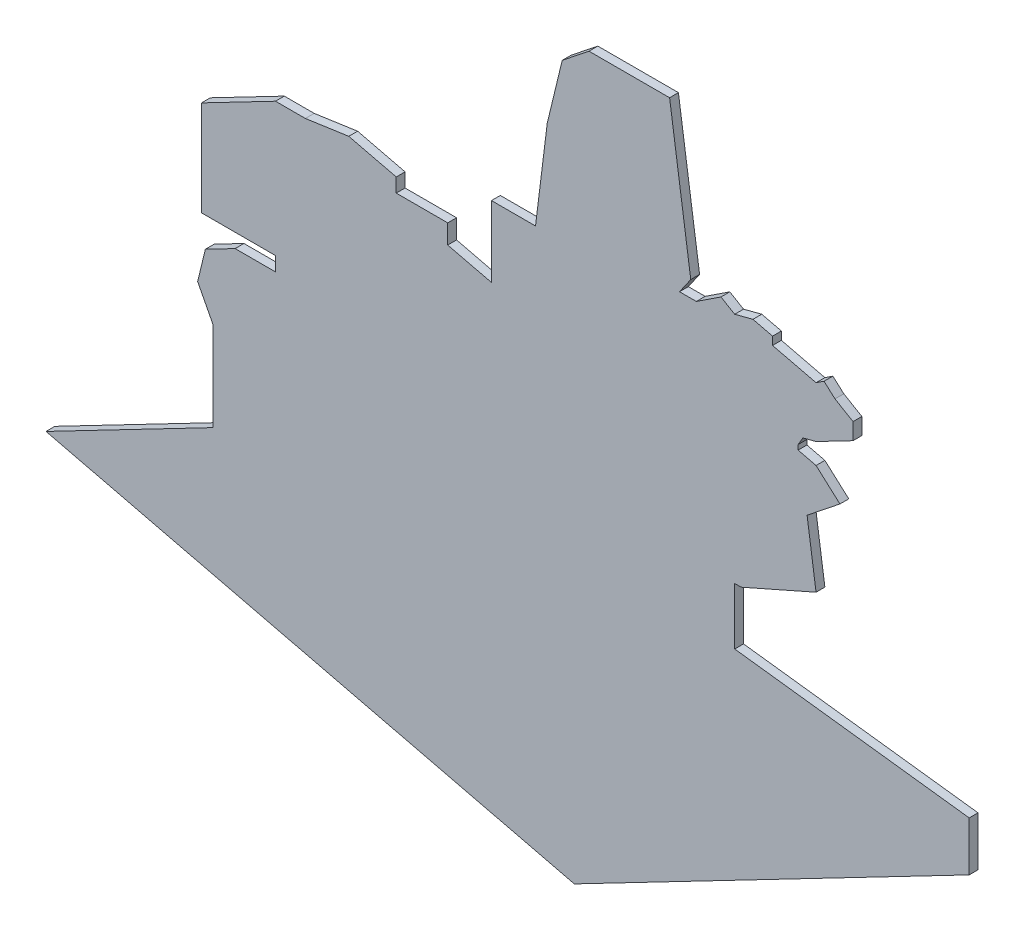
from build123d import *

# Parameters (mm, degrees)
AUFSATZ_LINEAR_AUSTRAGEN1_DEPTH = 2


with BuildPart() as part:
    # Skizze1 → Aufsatz-Linear austragen1 (new body)
    with BuildSketch(Plane.XY):
        Polygon((126.215995869, 93.72314004), (130.025876451, 93.72314004), (135.595633387, 97.38954443), (138.718293672, 95.556342235), (142.844671433, 96.629977996), (147.286818563, 95.556342235), (147.286818563, 93.72314004), (157.138174255, 91.342136563), (158.946705069, 92.532638301), (161.425092467, 90.311861568), (165.521072329, 87.907258253), (165.521072329, 84.158745075), (157.138174255, 79.801706236), (154.161759315, 79.027277499), (153.074965654, 77.17604286), (153.074965654, 76.08832996), (157.138174255, 75.10628098), (158.946705069, 73.485734023), (162.549971035, 70.257001813), (155.106569955, 64.335109931), (157.138174255, 50.240352889), (140.181002279, 42.752564778), (138.718293672, 42.752564778), (138.718293672, 29.895134459), (191.818980244, 23.319015351), (191.818980244, 12.135974598), (102.392093357, -34.343943925), (-17.273133713, -5.421699037), (20.56292279, 14.243715747), (20.56292279, 34.449415172), (17.079292064, 41.151884986), (18.821107427, 48.358612255), (25.556462177, 51.859335035), (34.70239759, 51.859335035), (34.70239759, 55.062538542), (17.950199746, 55.062538542), (17.950199746, 76.63218641), (34.70239759, 85.339196326), (41.469675345, 85.339196326), (51.303413636, 86.75662161), (62.052077393, 84.158745075), (62.052077393, 80.985691368), (73.7183454, 80.985691368), (73.7183454, 76.63218641), (83.622998605, 74.238301298), (83.622998605, 90.311861568), (93.594862899, 90.311861568), (96.253356842, 111.778603776), (99.649825979, 125.83142893), (105.714042553, 130.656056075), (123.966404927, 130.656056075), (126.215995869, 115.048962824), (128.761406921, 97.38954443), align=None)
    extrude(amount=AUFSATZ_LINEAR_AUSTRAGEN1_DEPTH)


solid = part.part
